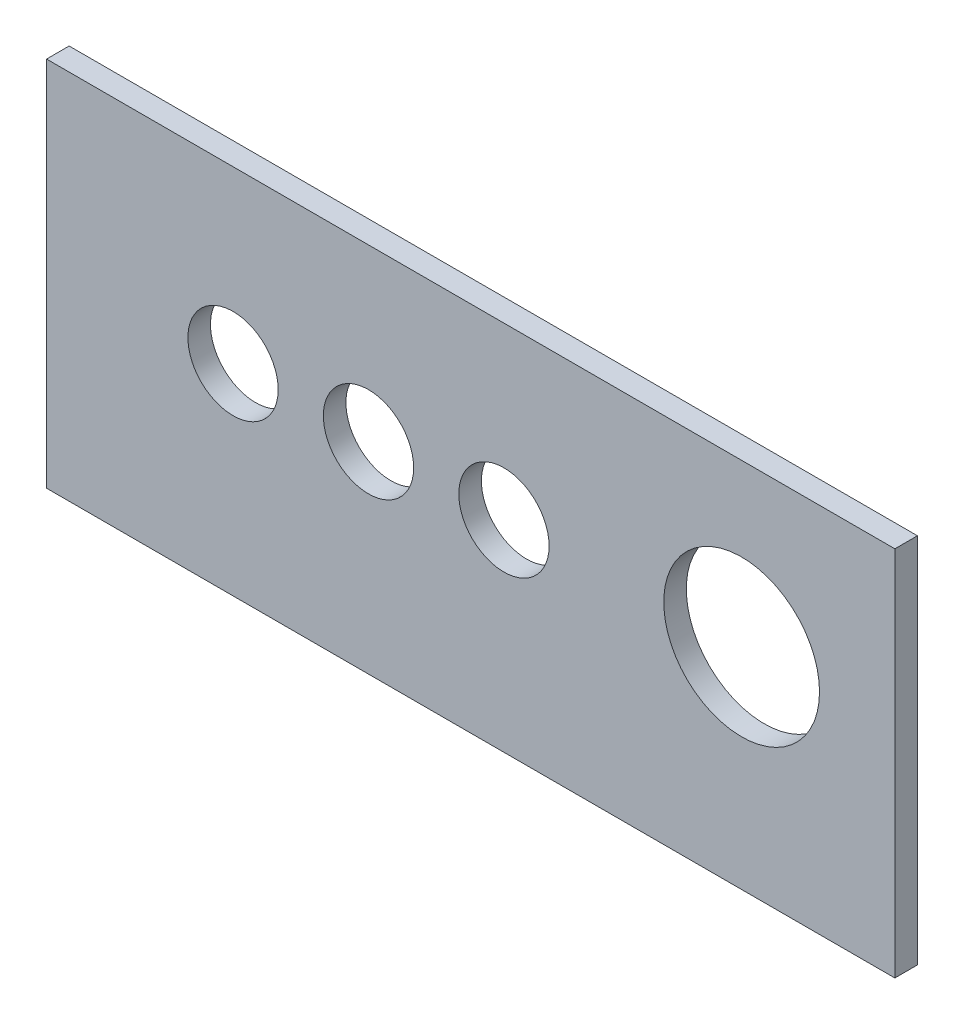
from build123d import *

# Parameters (mm, degrees)
MODEL_W             = 477.189260789
MODEL_H             = 209.095023119
BOSS_EXTRUDE1_DEPTH = 12.7


with BuildPart() as part:
    # Model → Boss-Extrude1 (new body)
    with BuildSketch(Plane.XY):
        with Locations((245.803972347, 112.449415536)):
            Rectangle(MODEL_W, MODEL_H)
        with BuildLine():
            ThreePointArc((239.098491904, 121.096908294), (264.498491904, 95.696908294), (289.898491904, 121.096908294))
            ThreePointArc((289.898491904, 121.096908294), (264.498491904, 146.496908294), (239.098491904, 121.096908294))
        make_face(mode=Mode.SUBTRACT)
        with BuildLine():
            ThreePointArc((162.898491904, 121.096908294), (188.298491904, 95.696908294), (213.698491904, 121.096908294))
            ThreePointArc((213.698491904, 121.096908294), (188.298491904, 146.496908294), (162.898491904, 121.096908294))
        make_face(mode=Mode.SUBTRACT)
        with BuildLine():
            ThreePointArc((137.498491904, 121.096908294), (112.098491904, 146.496908294), (86.698491904, 121.096908294))
            ThreePointArc((86.698491904, 121.096908294), (112.098491904, 95.696908294), (137.498491904, 121.096908294))
        make_face(mode=Mode.SUBTRACT)
        with BuildLine():
            ThreePointArc((442.018972347, 126.103389526), (398.203972347, 169.918389526), (354.388972347, 126.103389526))
            ThreePointArc((354.388972347, 126.103389526), (398.203972347, 82.288389526), (442.018972347, 126.103389526))
        make_face(mode=Mode.SUBTRACT)
    extrude(amount=BOSS_EXTRUDE1_DEPTH)


solid = part.part
